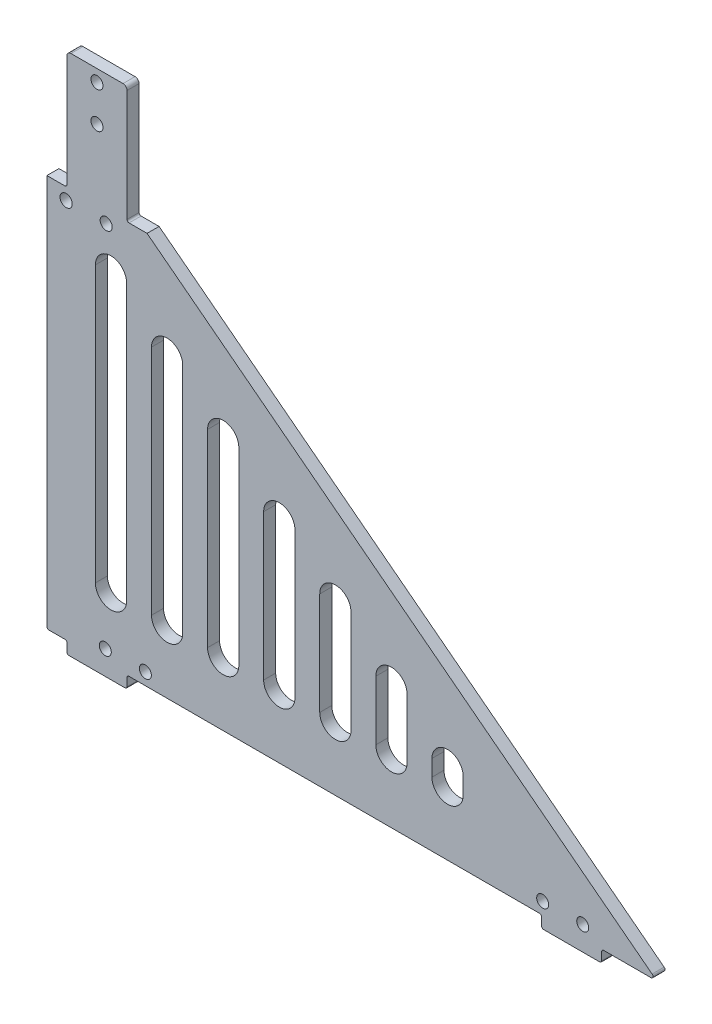
from build123d import *

# Parameters (mm, degrees)
EXTRUDE_1_DEPTH      = 3
SKETCH_2_W           = 15
SKETCH_2_H           = 3
EXTRUDE_2_DEPTH      = 0.5
FILLET_2_R           = 3
FILLET_3_R           = 0.5
FILLET_4_R           = 0.5
SKETCH_6_W           = 103.474287265
SKETCH_6_H           = 3
CUT_EXTRUDE_3_DEPTH  = 10
FILLET_5_R           = 0.5
FILLET_6_R           = 0.5
SKETCH_15_W          = 15
SKETCH_15_H          = 9
EXTRUDE_4_DEPTH      = 3
FILLET_7_R           = 1
SKETCH_16_R          = 1.5
CUT_EXTRUDE_7_DEPTH  = 188.894654659
SKETCH_17_R          = 1.52921897
SKETCH_17_R_2        = 1.502123086
CUT_EXTRUDE_8_DEPTH  = 188.894654659
EXTRUDE_5_DEPTH      = 3
SKETCH_19_R          = 1.5
CUT_EXTRUDE_9_DEPTH  = 10
EXTRUDE_6_DEPTH      = 3
CUT_EXTRUDE_10_DEPTH = 3


with BuildPart() as part:
    # 草图1 → 凸台-拉伸1 (new body)
    with BuildSketch(Plane.XY):
        Polygon((0, 101), (0, 0), (157.65, 0), (25, 79), (25, 101), (20, 101), (20, 104), (5, 104), (5, 101), align=None)
    extrude(amount=EXTRUDE_1_DEPTH)

    # 草图2 → 凸台-拉伸2 (add)
    with BuildSketch(Plane(origin=(0, 104, 0), x_dir=(1, 0, 0), z_dir=(0, 1, 0))):
        with Locations((12.5, -1.5)):
            Rectangle(SKETCH_2_W, SKETCH_2_H)
    extrude(amount=EXTRUDE_2_DEPTH)

    # 圆角2
    fillet_2_edges = [part.edges().sort_by_distance(p)[0] for p in [
        (25, 79, 1.5),
    ]]
    fillet(fillet_2_edges, radius=FILLET_2_R)

    # 圆角3
    fillet_3_edges = [part.edges().sort_by_distance(p)[0] for p in [
        (157.65, 0, 1.5),
    ]]
    fillet(fillet_3_edges, radius=FILLET_3_R)

    # 圆角4
    fillet_4_edges = [part.edges().sort_by_distance(p)[0] for p in [
        (0, 0, 1.5),
    ]]
    fillet(fillet_4_edges, radius=FILLET_4_R)

    # 草图6 → 切除-拉伸3 (cut)
    with BuildSketch(Plane.XY.offset(3)):
        with BuildLine():
            Line((5, 3), (0, 3))
            Line((0, 3), (0, 0.5))
            ThreePointArc((0, 0.5), (0.146446609, 0.146446609), (0.5, 0))
            Line((0.5, 0), (5, 0))
            Line((5, 0), (5, 3))
        make_face()
        with Locations((71.737143632, 1.5)):
            Rectangle(SKETCH_6_W, SKETCH_6_H)
        with BuildLine():
            Line((152.612658228, 3), (138.474287265, 3))
            Line((138.474287265, 3), (138.474287265, 0))
            Line((138.474287265, 0), (155.833275758, 0))
            ThreePointArc((155.833275758, 0), (156.315351251, 0.367322877), (156.089117317, 0.929587124))
            Line((156.089117317, 0.929587124), (152.612658228, 3))
        make_face()
    extrude(amount=-CUT_EXTRUDE_3_DEPTH, mode=Mode.SUBTRACT)

    # 圆角5
    fillet_5_edges = [part.edges().sort_by_distance(p)[0] for p in [
        (20, 0, 1.5),
        (5, 0, 1.5),
        (0, 3, 1.5),
        (123.474287265, 0, 1.5),
        (138.474287265, 0, 1.5),
        (152.612658228, 3, 1.5),
    ]]
    fillet(fillet_5_edges, radius=FILLET_5_R)

    # 圆角6
    fillet_6_edges = [part.edges().sort_by_distance(p)[0] for p in [
        (20, 101, 1.5),
        (5, 101, 1.5),
        (123.474287265, 3, 1.5),
        (138.474287265, 3, 1.5),
        (20, 3, 1.5),
        (5, 3, 1.5),
    ]]
    fillet(fillet_6_edges, radius=FILLET_6_R)

    # 草图15 → 凸台-拉伸4 (add)
    with BuildSketch(Plane(origin=(0, 0, 0), x_dir=(-1, 0, 0), z_dir=(0, 0, -1))):
        with Locations((-12.5, 106.877473525)):
            Rectangle(SKETCH_15_W, SKETCH_15_H)
    extrude(amount=-EXTRUDE_4_DEPTH)

    # 圆角7
    fillet_7_edges = [part.edges().sort_by_distance(p)[0] for p in [
        (5, 111.377473525, 1.5),
        (20, 111.377473525, 1.5),
    ]]
    fillet(fillet_7_edges, radius=FILLET_7_R)

    # 草图16 → 切除-拉伸7 (cut, through all)
    with BuildSketch(Plane(origin=(0, 0, 0), x_dir=(-1, 0, 0), z_dir=(0, 0, -1))):
        with Locations((-14.568919479, 6)):
            Circle(SKETCH_16_R)
        with Locations((-24.568919479, 6)):
            Circle(SKETCH_16_R)
        with Locations((-123.740220593, 6)):
            Circle(SKETCH_16_R)
        with Locations((-133.740220593, 6)):
            Circle(SKETCH_16_R)
    extrude(amount=-CUT_EXTRUDE_7_DEPTH, mode=Mode.SUBTRACT)

    # 草图17 → 切除-拉伸8 (cut, through all)
    with BuildSketch(Plane.XY.offset(3)):
        with Locations((4.795751321, 98)):
            Circle(SKETCH_17_R)
        with Locations((14.795751321, 98)):
            Circle(SKETCH_17_R_2)
    extrude(amount=-CUT_EXTRUDE_8_DEPTH, mode=Mode.SUBTRACT)

    # 草图18 → 凸台-拉伸5 (add)
    with BuildSketch(Plane.XY.offset(3)):
        with BuildLine():
            Line((19, 130.377473525), (6, 130.377473525))
            ThreePointArc((6, 130.377473525), (5.292893219, 130.084580306), (5, 129.377473525))
            Line((5, 129.377473525), (5, 110.377473525))
            Line((5, 110.377473525), (20, 110.377473525))
            Line((20, 110.377473525), (20, 129.377473525))
            ThreePointArc((20, 129.377473525), (19.707106781, 130.084580306), (19, 130.377473525))
        make_face()
    extrude(amount=-EXTRUDE_5_DEPTH)

    # 草图19 → 切除-拉伸9 (cut)
    with BuildSketch(Plane.XY.offset(3)):
        with Locations((12.5, 127.377473525)):
            Circle(SKETCH_19_R)
        with Locations((12.5, 118.377473525)):
            Circle(SKETCH_19_R)
    extrude(amount=-CUT_EXTRUDE_9_DEPTH, mode=Mode.SUBTRACT)

    # 草图21 → 凸台-拉伸6 (add)
    with BuildSketch(Plane.XY.offset(3)):
        with BuildLine():
            Line((25, 101), (151.051775545, 3.929587124))
            Line((151.051775545, 3.929587124), (26.464950647, 78.127545412))
            ThreePointArc((26.464950647, 78.127545412), (25.391825537, 79.222696415), (25, 80.705068154))
            Line((25, 80.705068154), (25, 101))
        make_face()
    extrude(amount=-EXTRUDE_6_DEPTH)

    # 草图22 → 切除-拉伸10 (cut)
    with BuildSketch(Plane(origin=(0, 0, 0), x_dir=(-1, 0, 0), z_dir=(0, 0, -1))):
        with BuildLine():
            Line((-19.9, 19), (-19.9, 87.736313508))
            ThreePointArc((-19.9, 87.736313508), (-16, 91.636313508), (-12.1, 87.736313508))
            Line((-12.1, 87.736313508), (-12.1, 19))
            ThreePointArc((-12.1, 19), (-16, 15.1), (-19.9, 19))
        make_face()
        with BuildLine():
            Line((-26.1, 76.955142244), (-26.1, 19))
            ThreePointArc((-26.1, 19), (-30, 15.1), (-33.9, 19))
            Line((-33.9, 19), (-33.9, 76.955142244))
            ThreePointArc((-33.9, 76.955142244), (-30, 80.855142244), (-26.1, 76.955142244))
        make_face()
        with BuildLine():
            Line((-40.1, 66.17397098), (-40.1, 19))
            ThreePointArc((-40.1, 19), (-44, 15.1), (-47.9, 19))
            Line((-47.9, 19), (-47.9, 66.17397098))
            ThreePointArc((-47.9, 66.17397098), (-44, 70.07397098), (-40.1, 66.17397098))
        make_face()
        with BuildLine():
            Line((-54.1, 55.392799717), (-54.1, 19))
            ThreePointArc((-54.1, 19), (-58, 15.1), (-61.9, 19))
            Line((-61.9, 19), (-61.9, 55.392799717))
            ThreePointArc((-61.9, 55.392799717), (-58, 59.292799717), (-54.1, 55.392799717))
        make_face()
        with BuildLine():
            Line((-68.1, 44.611628453), (-68.1, 19))
            ThreePointArc((-68.1, 19), (-72, 15.1), (-75.9, 19))
            Line((-75.9, 19), (-75.9, 44.611628453))
            ThreePointArc((-75.9, 44.611628453), (-72, 48.511628453), (-68.1, 44.611628453))
        make_face()
        with BuildLine():
            Line((-82.1, 33.830457189), (-82.1, 19))
            ThreePointArc((-82.1, 19), (-86, 15.1), (-89.9, 19))
            Line((-89.9, 19), (-89.9, 33.830457189))
            ThreePointArc((-89.9, 33.830457189), (-86, 37.730457189), (-82.1, 33.830457189))
        make_face()
        with BuildLine():
            Line((-96.1, 23.049285925), (-96.1, 19))
            ThreePointArc((-96.1, 19), (-100, 15.1), (-103.9, 19))
            Line((-103.9, 19), (-103.9, 23.049285925))
            ThreePointArc((-103.9, 23.049285925), (-100, 26.949285925), (-96.1, 23.049285925))
        make_face()
    extrude(amount=-CUT_EXTRUDE_10_DEPTH, mode=Mode.SUBTRACT)


solid = part.part
